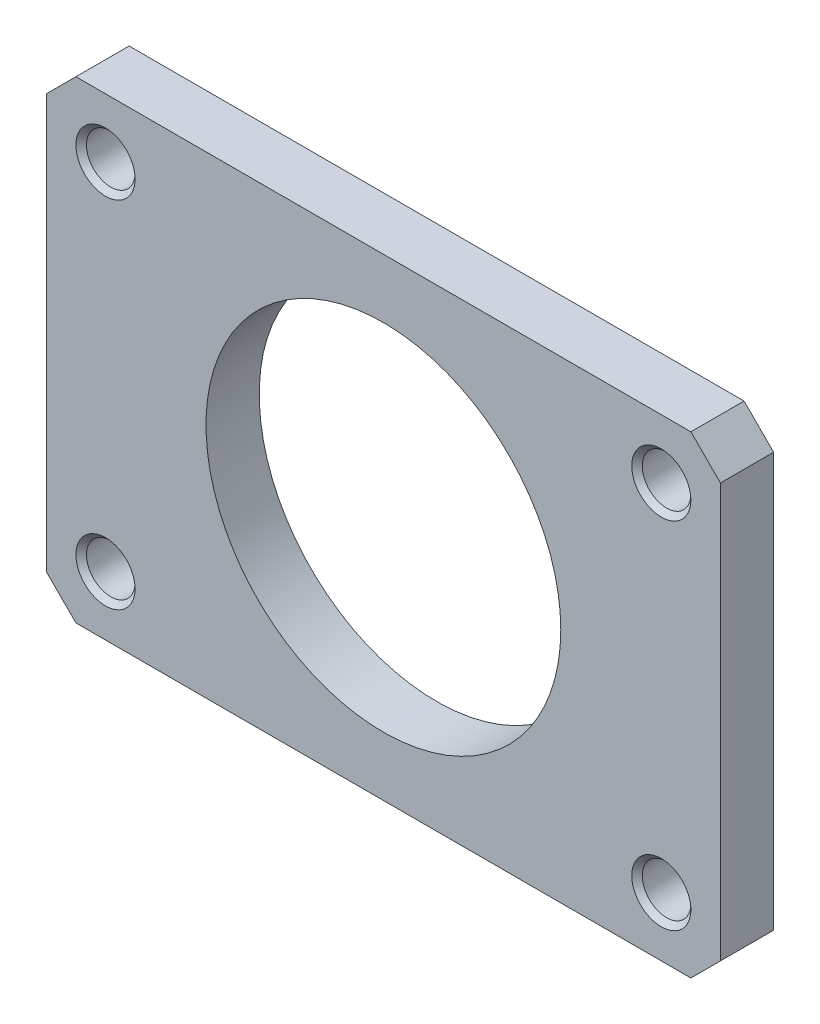
from build123d import *

# Parameters (mm, degrees)
SKETCH_1_W          = 28.5
SKETCH_1_H          = 20
SKETCH_1_R          = 2.055
EXTRUDE_1_DEPTH     = 4.5
CHAMFER_1_SIZE      = 2.5
CHAMFER_2_SIZE      = 0.445
SKETCH_2_R          = 15
CUT_EXTRUDE_1_DEPTH = 53.419581265


with BuildPart() as part:
    # Эскиз1 → Бобышка-Вытянуть1 (new body)
    with BuildSketch(Plane.XY):
        Rectangle(SKETCH_1_W, SKETCH_1_H)
        with Locations((9.25, 5)):
            Circle(SKETCH_1_R, mode=Mode.SUBTRACT)
    extrude(amount=EXTRUDE_1_DEPTH)

    # Фаска1
    chamfer_1_edges = [part.edges().sort_by_distance(p)[0] for p in [
        (14.25, 10, 2.25),
    ]]
    chamfer(chamfer_1_edges, length=CHAMFER_1_SIZE)

    # Фаска2
    chamfer_2_edges = [part.edges().sort_by_distance(p)[0] for p in [
        (7.195, 5, 0),
        (7.195, 5, 4.5),
    ]]
    chamfer(chamfer_2_edges, length=CHAMFER_2_SIZE)

    # Зеркальное отражение1: part across plane


with BuildPart() as part_1:
    add(part.part)
    add(part.part.mirror(Plane(origin=(-14.25, -10, 4.5), x_dir=(0, 0, 1), z_dir=(0, 1, 0))))

    # Зеркальное отражение2: part across plane


with BuildPart() as part_2:
    add(part_1.part)
    add(part_1.part.mirror(Plane(origin=(-14.25, -10, 4.5), x_dir=(0, 0, 1), z_dir=(1, 0, 0))))

    # Эскиз2 → Вырез-Вытянуть1 (cut, through all)
    with BuildSketch(Plane.XY.offset(4.5)):
        with Locations((-14.25, -10)):
            Circle(SKETCH_2_R)
    extrude(amount=-CUT_EXTRUDE_1_DEPTH, mode=Mode.SUBTRACT)


solid = part_2.part
